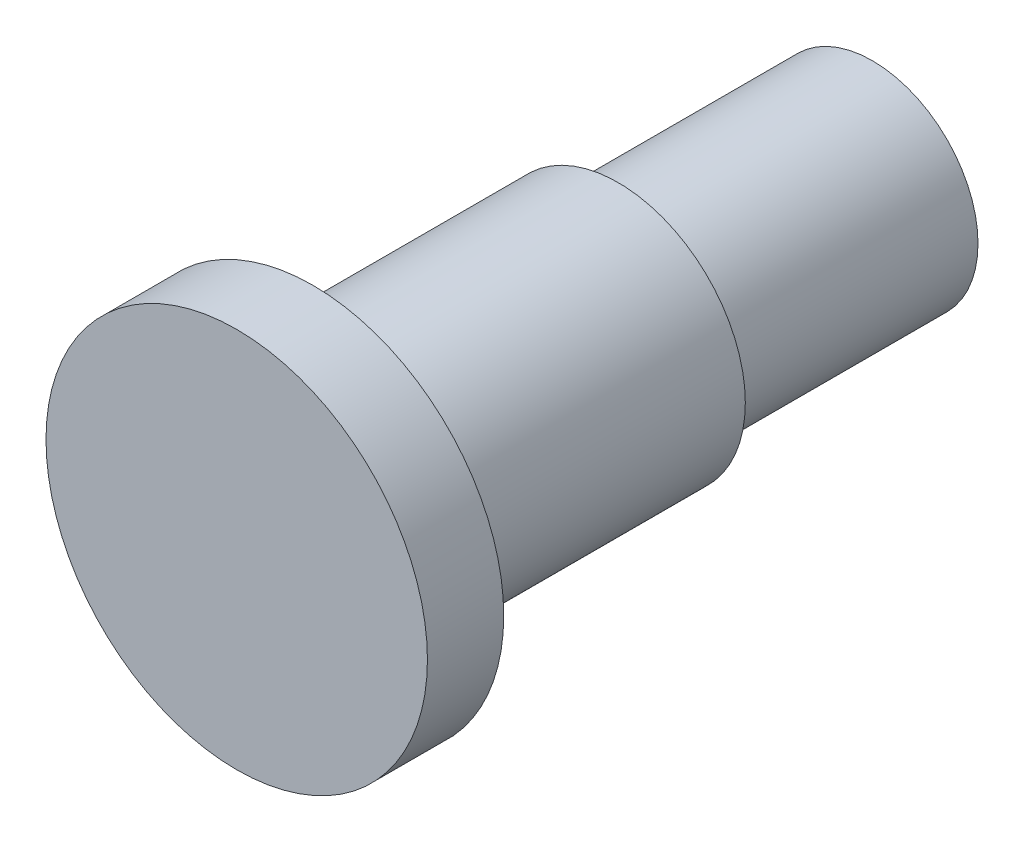
from build123d import *

# Parameters (mm, degrees)
M10_START                                     = -10
SKETCH1_R                                     = 4.15
M10_ROD_ENGAGEMENT_THREAD_CORE_REPRESEN_DEPTH = 10
SKETCH2_R                                     = 5
FLOATING_SHOULDER_THROUGH_BRIDGE_DEPTH        = 12
CAPTIVE_START                                 = 12
SKETCH3_R                                     = 7.5
CAPTIVE_THRUST_HEAD_DEPTH                     = 3


with BuildPart() as part:
    # Sketch1 → M10 rod engagement, thread core represented (new body)
    with BuildSketch(Plane.XY.offset(M10_START)):
        Circle(SKETCH1_R)
    extrude(amount=M10_ROD_ENGAGEMENT_THREAD_CORE_REPRESEN_DEPTH)

    # Sketch2 → Floating shoulder through bridge (add)
    with BuildSketch(Plane.XY):
        Circle(SKETCH2_R)
    extrude(amount=FLOATING_SHOULDER_THROUGH_BRIDGE_DEPTH)

    # Sketch3 → Captive thrust head (add)
    with BuildSketch(Plane.XY.offset(CAPTIVE_START)):
        Circle(SKETCH3_R)
    extrude(amount=CAPTIVE_THRUST_HEAD_DEPTH)


solid = part.part
